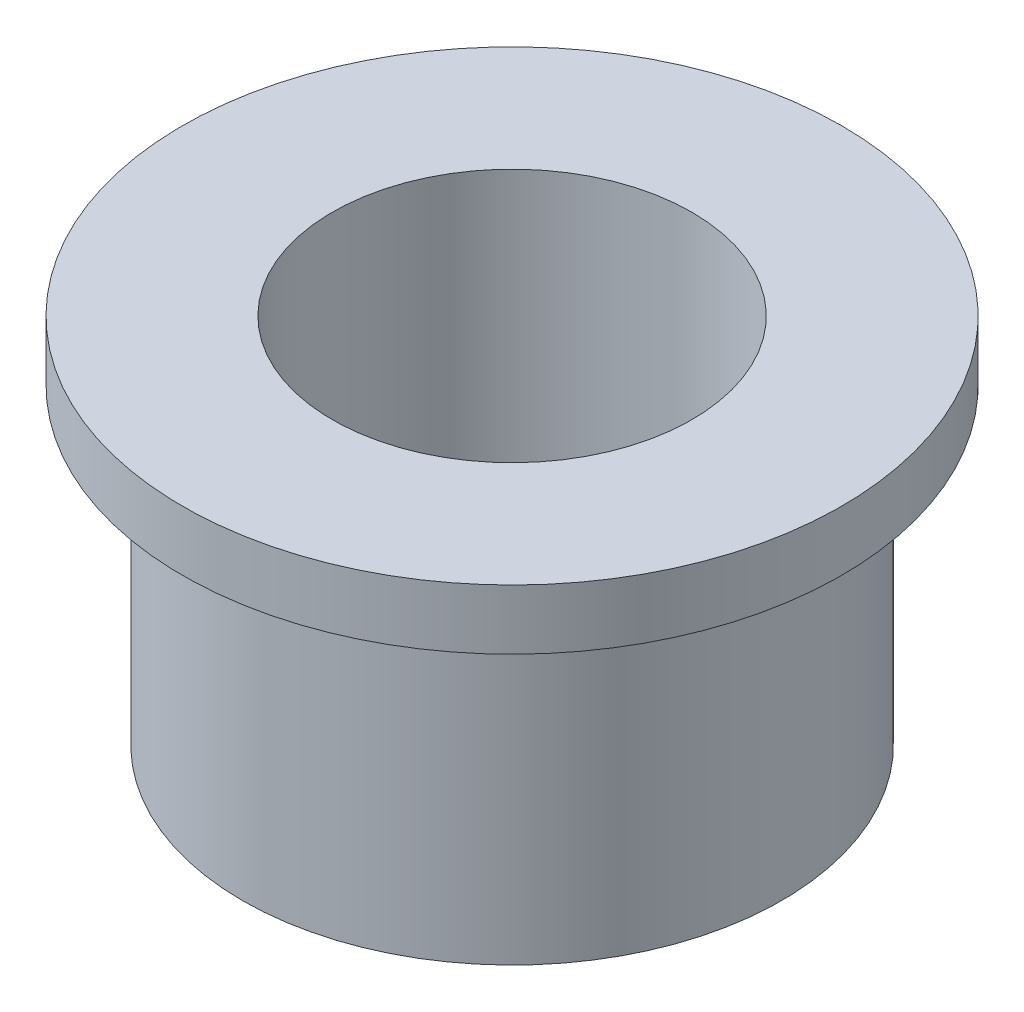
from build123d import *


with BuildPart() as part:
    # Szkic1 → Obrót1 (revolve)
    with BuildSketch(Plane.XY, mode=Mode.PRIVATE) as obr_t1_sk:
        Polygon((-15, 0), (-22.5, 0), (-22.5, 26), (-27.5, 26), (-27.5, 31), (-15, 31), align=None)
    revolve(obr_t1_sk.sketch.rotate(Axis((0, 0, 0), (0, 1, 0)), 270), axis=Axis((0, 0, 0), (0, 1, 0)))


solid = part.part
